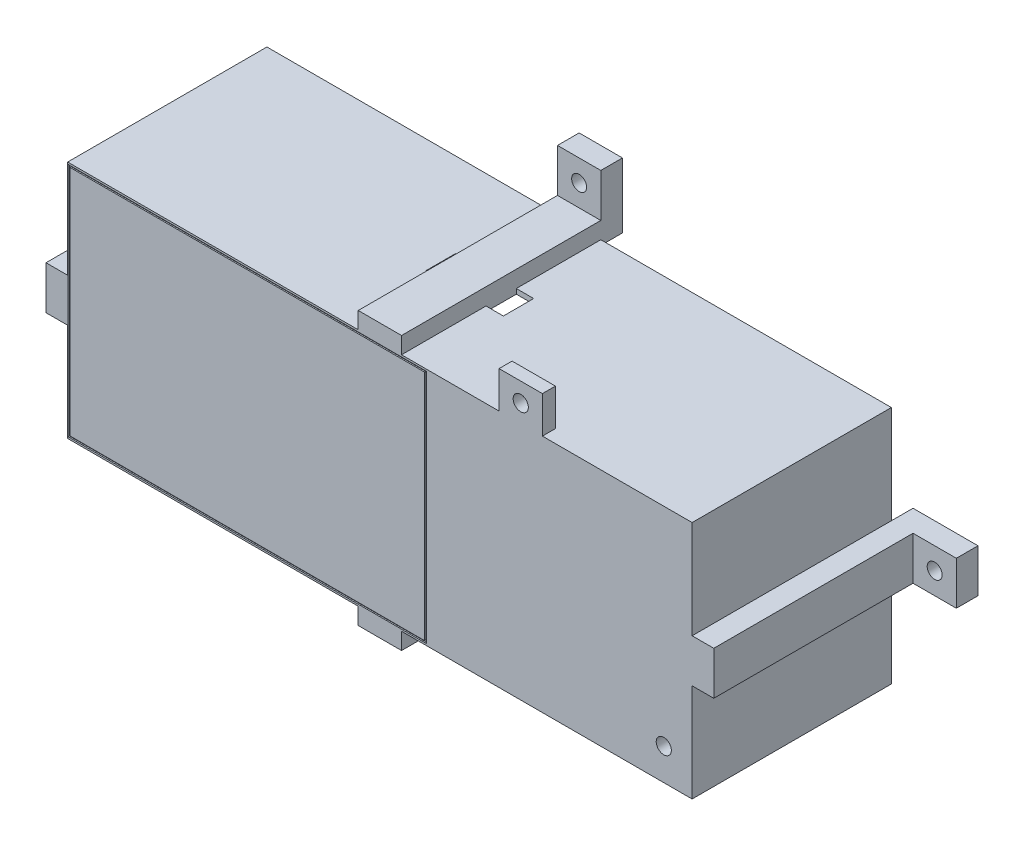
from build123d import *

# Parameters (mm, degrees)
SKETCH2_W             = 5
SKETCH2_H             = 10
BOSS_EXTRUDE1_DEPTH   = 48
SKETCH2_W_2           = 10
SKETCH2_H_2           = 5
BOSS_EXTRUDE1_2_DEPTH = 48
BOSS_EXTRUDE1_3_DEPTH = 48
BOSS_EXTRUDE1_4_DEPTH = 48
SKETCH3_W             = 165
SKETCH3_H             = 55.28
BOSS_EXTRUDE2_DEPTH   = 3
SKETCH4_W             = 10
SKETCH4_H             = 3.86
BOSS_EXTRUDE3_DEPTH   = 3
SKETCH5_W             = 10
SKETCH5_H             = 5
BOSS_EXTRUDE4_DEPTH   = 10
SKETCH7_W             = 5
SKETCH7_H             = 10
BOSS_EXTRUDE5_DEPTH   = 10
SKETCH8_R             = 1.73
CUT_EXTRUDE1_DEPTH    = 107.873978241
SKETCH10_W            = 10
SKETCH10_H            = 8.5
SKETCH10_W_2          = 1.85
SKETCH10_H_2          = 10
BOSS_EXTRUDE6_DEPTH   = 3
SKETCH11_R            = 1.75
CUT_EXTRUDE3_DEPTH    = 110.119417268
SKETCH12_W            = 82.72
SKETCH12_H            = 54.46
SKETCH12_W_2          = 81.92
SKETCH12_H_2          = 53.66
CUT_EXTRUDE4_DEPTH    = 0.28
CUT_EXTRUDE5_DEPTH    = 108.749929118
BOSS_EXTRUDE7_DEPTH   = 43
CUT_EXTRUDE6_DEPTH    = 33.5
SKETCH16_W            = 4
SKETCH16_H            = 7
CUT_EXTRUDE7_DEPTH    = 1.14
SKETCH17_W            = 4
SKETCH17_H            = 7
CUT_EXTRUDE8_DEPTH    = 1.14


with BuildPart() as part:
    # Sketch2 → Boss-Extrude1 (new body)
    with BuildSketch(Plane.XY):
        with Locations((-74.585, 0)):
            Rectangle(SKETCH2_W, SKETCH2_H)
    extrude(amount=BOSS_EXTRUDE1_DEPTH)



with BuildPart() as body_2:
    # Sketch2 → Boss-Extrude1 2 (new body)
    with BuildSketch(Plane.XY):
        with Locations((0, 29)):
            Rectangle(SKETCH2_W_2, SKETCH2_H_2)
    extrude(amount=BOSS_EXTRUDE1_2_DEPTH)


with BuildPart() as body_3:
    # Sketch2 → Boss-Extrude1 3 (new body)
    with BuildSketch(Plane.XY):
        with Locations((74.585, 0)):
            Rectangle(SKETCH2_W, SKETCH2_H)
    extrude(amount=BOSS_EXTRUDE1_3_DEPTH)


with BuildPart() as body_4:
    # Sketch2 → Boss-Extrude1 4 (new body)
    with BuildSketch(Plane.XY):
        with Locations((0, -29)):
            Rectangle(SKETCH2_W_2, SKETCH2_H_2)
    extrude(amount=BOSS_EXTRUDE1_4_DEPTH)


with BuildPart() as part_1:
    add(part.part)

    add(body_2.part)  # Boss-Extrude2 merges body 2

    add(body_3.part)  # Boss-Extrude2 merges body 3

    add(body_4.part)  # Boss-Extrude2 merges body 4
    # Sketch3 → Boss-Extrude2 (add)
    with BuildSketch(Plane.XY.offset(48)):
        Rectangle(SKETCH3_W, SKETCH3_H)
    extrude(amount=BOSS_EXTRUDE2_DEPTH)

    # Sketch4 → Boss-Extrude3 (add)
    with BuildSketch(Plane.XY.offset(48)):
        with Locations((0, 29.57)):
            Rectangle(SKETCH4_W, SKETCH4_H)
        with Locations((0, -29.57)):
            Rectangle(SKETCH4_W, SKETCH4_H)
    extrude(amount=BOSS_EXTRUDE3_DEPTH)

    # Sketch5 → Boss-Extrude4 (add)
    with BuildSketch(Plane(origin=(0, 5, 0), x_dir=(1, 0, 0), z_dir=(0, 1, 0))):
        with Locations((-82.085, -2.5)):
            Rectangle(SKETCH5_W, SKETCH5_H)
        with Locations((82.085, -2.5)):
            Rectangle(SKETCH5_W, SKETCH5_H)
    extrude(amount=-BOSS_EXTRUDE4_DEPTH)

    # Sketch7 → Boss-Extrude5 (add)
    with BuildSketch(Plane.ZY.offset(5)):
        with Locations((2.5, 36.5)):
            Rectangle(SKETCH7_W, SKETCH7_H)
        with Locations((2.5, -36.5)):
            Rectangle(SKETCH7_W, SKETCH7_H)
    extrude(amount=-BOSS_EXTRUDE5_DEPTH)

    # Sketch8 → Cut-Extrude1 (cut, through all)
    with BuildSketch(Plane.XY.offset(5)):
        with Locations((-82.085, 0)):
            Circle(SKETCH8_R)
        with Locations((0, -36.5)):
            Circle(SKETCH8_R)
        with Locations(Location((82.085, 0, 0), (0, 0, 180))):
            Circle(SKETCH8_R)
        with Locations(Location((0, 36.5, 0), (0, 0, 180))):
            Circle(SKETCH8_R)
    extrude(amount=-CUT_EXTRUDE1_DEPTH, mode=Mode.SUBTRACT)

    # Sketch10 → Boss-Extrude6 (add)
    with BuildSketch(Plane.XY.offset(51)):
        with Locations((32.52, 31.89)):
            Rectangle(SKETCH10_W, SKETCH10_H)
        with Locations((69.005, -20.32)):
            Rectangle(SKETCH10_W_2, SKETCH10_H_2)
    extrude(amount=-BOSS_EXTRUDE6_DEPTH)

    # Sketch11 → Cut-Extrude3 (cut, through all)
    with BuildSketch(Plane.XY.offset(51)):
        with Locations((32.52, 31.75)):
            Circle(SKETCH11_R)
        with Locations((65.54, -20.32)):
            Circle(SKETCH11_R)
    extrude(amount=-CUT_EXTRUDE3_DEPTH, mode=Mode.SUBTRACT)

    # Sketch12 → Cut-Extrude4 (cut)
    with BuildSketch(Plane.XY.offset(51)):
        with Locations((-30.625, 0)):
            Rectangle(SKETCH12_W, SKETCH12_H)
        with Locations((-30.625, 0)):
            Rectangle(SKETCH12_W_2, SKETCH12_H_2, mode=Mode.SUBTRACT)
    extrude(amount=-CUT_EXTRUDE4_DEPTH, mode=Mode.SUBTRACT)

    # Sketch13 → Cut-Extrude5 (cut, through all)
    with BuildSketch(Plane(origin=(0, 0, 48), x_dir=(-1, 0, 0), z_dir=(0, 0, -1))):
        Polygon((82.5, -27.64), (82.5, 27.64), (72.085, 27.64), (72.085, 5), (77.085, 5), (77.085, -5), (72.085, -5), (72.085, -27.64), align=None)
        Polygon((-82.5, 27.64), (-82.5, -27.64), (-72.085, -27.64), (-72.085, -5), (-77.085, -5), (-77.085, 5), (-72.085, 5), (-72.085, 27.64), align=None)
    extrude(amount=-CUT_EXTRUDE5_DEPTH, mode=Mode.SUBTRACT)

    # Sketch14 → Boss-Extrude7 (add)
    with BuildSketch(Plane(origin=(0, 0, 48), x_dir=(-1, 0, 0), z_dir=(0, 0, -1))):
        Polygon((72.085, -27.64), (5, -27.64), (5, -26.5), (70.945, -26.5), (70.945, -5), (70.945, 5), (70.945, 26.5), (5, 26.5), (5, 27.64), (72.085, 27.64), (72.085, 5), (72.085, -5), align=None)
        Polygon((-72.085, 5), (-72.085, -5), (-72.085, -27.64), (-5, -27.64), (-5, -26.5), (-70.945, -26.5), (-70.945, -5), (-70.945, 5), (-70.945, 26.5), (-37.52, 26.5), (-27.52, 26.5), (-5, 26.5), (-5, 27.64), (-27.52, 27.64), (-37.52, 27.64), (-72.085, 27.64), align=None)
    extrude(amount=BOSS_EXTRUDE7_DEPTH)

    # Sketch15 → Cut-Extrude6 (cut)
    with BuildSketch(Plane(origin=(0, 0, 5), x_dir=(-1, 0, 0), z_dir=(0, 0, -1))):
        Polygon((72.085, -17.64), (70.945, -17.64), (70.945, -26.5), (62.085, -26.5), (62.085, -27.64), (72.085, -27.64), align=None)
    extrude(amount=-CUT_EXTRUDE6_DEPTH, mode=Mode.SUBTRACT)

    # Sketch16 → Cut-Extrude7 (cut)
    with BuildSketch(Plane.XZ.offset(27.64)):
        with Locations((7, 34.5)):
            Rectangle(SKETCH16_W, SKETCH16_H)
        with Locations((7, 13.5)):
            Rectangle(SKETCH16_W, SKETCH16_H)
        with Locations((-7, 13.5)):
            Rectangle(SKETCH16_W, SKETCH16_H)
        with Locations((-7, 34.5)):
            Rectangle(SKETCH16_W, SKETCH16_H)
    extrude(amount=-CUT_EXTRUDE7_DEPTH, mode=Mode.SUBTRACT)

    # Sketch17 → Cut-Extrude8 (cut)
    with BuildSketch(Plane(origin=(0, 27.64, 0), x_dir=(1, 0, 0), z_dir=(0, 1, 0))):
        with Locations((7, -28)):
            Rectangle(SKETCH17_W, SKETCH17_H)
        with Locations((-7, -28)):
            Rectangle(SKETCH17_W, SKETCH17_H)
    extrude(amount=-CUT_EXTRUDE8_DEPTH, mode=Mode.SUBTRACT)


solid = part_1.part
